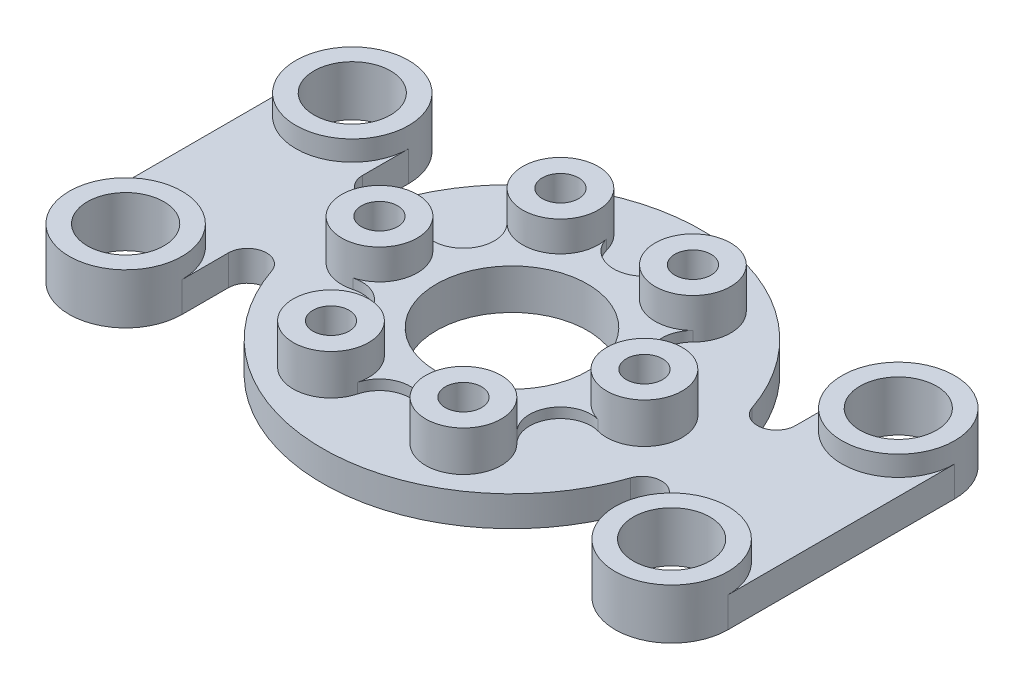
from build123d import *

# Parameters (mm, degrees)
BOSS_EXTRUDE1_DEPTH = 30
SKETCH1_3_R         = 56
SKETCH1_3_R_2       = 38
BOSS_EXTRUDE2_DEPTH = 50
SKETCH1_4_R         = 75
BOSS_EXTRUDE3_DEPTH = 40
SKETCH1_5_R         = 37.5
SKETCH1_5_R_2       = 18
BOSS_EXTRUDE4_DEPTH = 70


with BuildPart() as part:
    # Sketch1 → Boss-Extrude1 (new body)
    with BuildSketch(Plane(origin=(0, 0, 0), x_dir=(1, 0, 0), z_dir=(0, 1, 0))):
        with BuildLine():
            Line((-215, 66.580778007), (-215, 112.5))
            ThreePointArc((-215, 112.5), (-271, 56.5), (-327, 112.5))
            Line((-327, 112.5), (-327, -112.5))
            ThreePointArc((-327, -112.5), (-271, -56.5), (-215, -112.5))
            Line((-215, -112.5), (-215, -66.580778007))
            ThreePointArc((-215, -66.580778007), (-199.097061097, -47.83489279), (-178.009661836, -60.469498866))
            ThreePointArc((-178.009661836, -60.469498866), (0, -188), (178.009661836, -60.469498866))
            ThreePointArc((178.009661836, -60.469498866), (199.097061097, -47.83489279), (215, -66.580778007))
            Line((215, -66.580778007), (215, -112.5))
            ThreePointArc((215, -112.5), (271, -56.5), (327, -112.5))
            Line((327, -112.5), (327, 112.5))
            ThreePointArc((327, 112.5), (271, 56.5), (215, 112.5))
            Line((215, 112.5), (215, 66.580778007))
            ThreePointArc((215, 66.580778007), (199.097061097, 47.83489279), (178.009661836, 60.469498866))
            ThreePointArc((178.009661836, 60.469498866), (0, 188), (-178.009661836, 60.469498866))
            ThreePointArc((-178.009661836, 60.469498866), (-199.097061097, 47.83489279), (-215, 66.580778007))
        make_face()
        with BuildLine():
            ThreePointArc((121.794279026, 36.222216668), (154.328550802, 29.750752398), (169, 0))
            ThreePointArc((169, 0), (154.328553545, -29.750750294), (121.794285703, -36.222218458))
            ThreePointArc((121.794285703, -36.222218458), (87.408455986, -50.465295497), (92.266504099, -87.365836108))
            ThreePointArc((92.266504099, -87.365836108), (100.395482416, -99.531711756), (103.25, -113.882340598))
            ThreePointArc((103.25, -113.882340598), (70.644732229, -151.061522896), (29.527781525, -123.58805483))
            ThreePointArc((29.527781525, -123.58805483), (1.17e-07, -100.930591138), (-29.527781464, -123.588054603))
            ThreePointArc((-29.527781464, -123.588054603), (-84.499999831, -146.358293337), (-92.266504435, -87.365836444))
            ThreePointArc((-92.266504435, -87.365836444), (-87.408455896, -50.465295654), (-121.794285812, -36.222218487))
            ThreePointArc((-121.794285812, -36.222218487), (-169, -7.12e-07), (-121.794287187, 36.222218855))
            ThreePointArc((-121.794287187, 36.222218855), (-87.408455347, 50.465296604), (-92.266506993, 87.365839002))
            ThreePointArc((-92.266506993, 87.365839002), (-84.499998373, 146.358294179), (-29.527781529, 123.588054845))
            ThreePointArc((-29.527781529, 123.588054845), (1.47e-07, 100.930591138), (29.527781605, 123.58805513))
            ThreePointArc((29.527781605, 123.58805513), (70.644732383, 151.061522876), (103.25, 113.882340598))
            ThreePointArc((103.25, 113.882340598), (100.395482507, 99.531711976), (92.266504435, 87.365836444))
            ThreePointArc((92.266504435, 87.365836444), (87.408454139, 50.465298696), (121.794279026, 36.222216668))
        make_face(mode=Mode.SUBTRACT)
    extrude(amount=BOSS_EXTRUDE1_DEPTH)

    # Sketch1<3> → Boss-Extrude2 (add)
    # profile 1 of 4: a face of its own
    with BuildSketch(Plane(origin=(0, 0, 0), x_dir=(1, 0, 0), z_dir=(0, 1, 0))):
        with Locations((-271, 112.5)):
            Circle(SKETCH1_3_R)
        with Locations((-271, 112.5)):
            Circle(SKETCH1_3_R_2, mode=Mode.SUBTRACT)
    # profile 2 of 4: a face of its own
    with BuildSketch(Plane(origin=(0, 0, 0), x_dir=(1, 0, 0), z_dir=(0, 1, 0))):
        with Locations((-271, -112.5)):
            Circle(SKETCH1_3_R)
        with Locations((-271, -112.5)):
            Circle(SKETCH1_3_R_2, mode=Mode.SUBTRACT)
    # profile 3 of 4: a face of its own
    with BuildSketch(Plane(origin=(0, 0, 0), x_dir=(1, 0, 0), z_dir=(0, 1, 0))):
        with Locations((271, 112.5)):
            Circle(SKETCH1_3_R)
        with Locations((271, 112.5)):
            Circle(SKETCH1_3_R_2, mode=Mode.SUBTRACT)
    # profile 4 of 4: a face of its own
    with BuildSketch(Plane(origin=(0, 0, 0), x_dir=(1, 0, 0), z_dir=(0, 1, 0))):
        with Locations((271, -112.5)):
            Circle(SKETCH1_3_R)
        with Locations((271, -112.5)):
            Circle(SKETCH1_3_R_2, mode=Mode.SUBTRACT)
    extrude(amount=BOSS_EXTRUDE2_DEPTH)

    # Sketch1<4> → Boss-Extrude3 (add)
    with BuildSketch(Plane(origin=(0, 0, 0), x_dir=(1, 0, 0), z_dir=(0, 1, 0))):
        with BuildLine():
            ThreePointArc((121.794285703, -36.222218458), (94, -3.457e-06), (121.794279026, 36.222216668))
            ThreePointArc((121.794279026, 36.222216668), (87.408454139, 50.465298696), (92.266504435, 87.365836444))
            ThreePointArc((92.266504435, 87.365836444), (46.999999933, 81.406387994), (29.527781605, 123.58805513))
            ThreePointArc((29.527781605, 123.58805513), (1.47e-07, 100.930591138), (-29.527781529, 123.588054845))
            ThreePointArc((-29.527781529, 123.588054845), (-28.570817702, 118.777072835), (-28.25, 113.882340598))
            ThreePointArc((-28.25, 113.882340598), (-51.399373049, 79.236857398), (-92.266506993, 87.365839002))
            ThreePointArc((-92.266506993, 87.365839002), (-87.408455347, 50.465296604), (-121.794287187, 36.222218855))
            ThreePointArc((-121.794287187, 36.222218855), (-101.749250173, 22.828554154), (-94, 0))
            ThreePointArc((-94, 0), (-101.74924974, -22.828553589), (-121.794285812, -36.222218487))
            ThreePointArc((-121.794285812, -36.222218487), (-87.408455896, -50.465295654), (-92.266504435, -87.365836444))
            ThreePointArc((-92.266504435, -87.365836444), (-51.399371378, -79.23685809), (-28.25, -113.882340598))
            ThreePointArc((-28.25, -113.882340598), (-28.570817686, -118.777072711), (-29.527781464, -123.588054603))
            ThreePointArc((-29.527781464, -123.588054603), (1.17e-07, -100.930591138), (29.527781525, -123.58805483))
            ThreePointArc((29.527781525, -123.58805483), (46.999999862, -81.406388035), (92.266504099, -87.365836108))
            ThreePointArc((92.266504099, -87.365836108), (87.408455986, -50.465295497), (121.794285703, -36.222218458))
        make_face()
        Circle(SKETCH1_4_R, mode=Mode.SUBTRACT)
    extrude(amount=BOSS_EXTRUDE3_DEPTH)

    # Sketch1<5> → Boss-Extrude4 (add)
    # profile 1 of 6: a face of its own
    with BuildSketch(Plane(origin=(0, 0, 0), x_dir=(1, 0, 0), z_dir=(0, 1, 0))):
        with Locations((131.5, 0)):
            Circle(SKETCH1_5_R)
        with Locations((131.5, 0)):
            Circle(SKETCH1_5_R_2, mode=Mode.SUBTRACT)
    # profile 2 of 6: a face of its own
    with BuildSketch(Plane(origin=(0, 0, 0), x_dir=(1, 0, 0), z_dir=(0, 1, 0))):
        with Locations((65.75, 113.882340598)):
            Circle(SKETCH1_5_R)
        with Locations((65.75, 113.882340598)):
            Circle(SKETCH1_5_R_2, mode=Mode.SUBTRACT)
    # profile 3 of 6: a face of its own
    with BuildSketch(Plane(origin=(0, 0, 0), x_dir=(1, 0, 0), z_dir=(0, 1, 0))):
        with Locations((65.75, -113.882340598)):
            Circle(SKETCH1_5_R)
        with Locations((65.75, -113.882340598)):
            Circle(SKETCH1_5_R_2, mode=Mode.SUBTRACT)
    # profile 4 of 6: a face of its own
    with BuildSketch(Plane(origin=(0, 0, 0), x_dir=(1, 0, 0), z_dir=(0, 1, 0))):
        with Locations((-65.75, 113.882340598)):
            Circle(SKETCH1_5_R)
        with Locations((-65.75, 113.882340598)):
            Circle(SKETCH1_5_R_2, mode=Mode.SUBTRACT)
    # profile 5 of 6: a face of its own
    with BuildSketch(Plane(origin=(0, 0, 0), x_dir=(1, 0, 0), z_dir=(0, 1, 0))):
        with Locations((-65.75, -113.882340598)):
            Circle(SKETCH1_5_R)
        with Locations((-65.75, -113.882340598)):
            Circle(SKETCH1_5_R_2, mode=Mode.SUBTRACT)
    # profile 6 of 6: a face of its own
    with BuildSketch(Plane(origin=(0, 0, 0), x_dir=(1, 0, 0), z_dir=(0, 1, 0))):
        with Locations((-131.5, 0)):
            Circle(SKETCH1_5_R)
        with Locations((-131.5, 0)):
            Circle(SKETCH1_5_R_2, mode=Mode.SUBTRACT)
    extrude(amount=BOSS_EXTRUDE4_DEPTH)


solid = part.part
